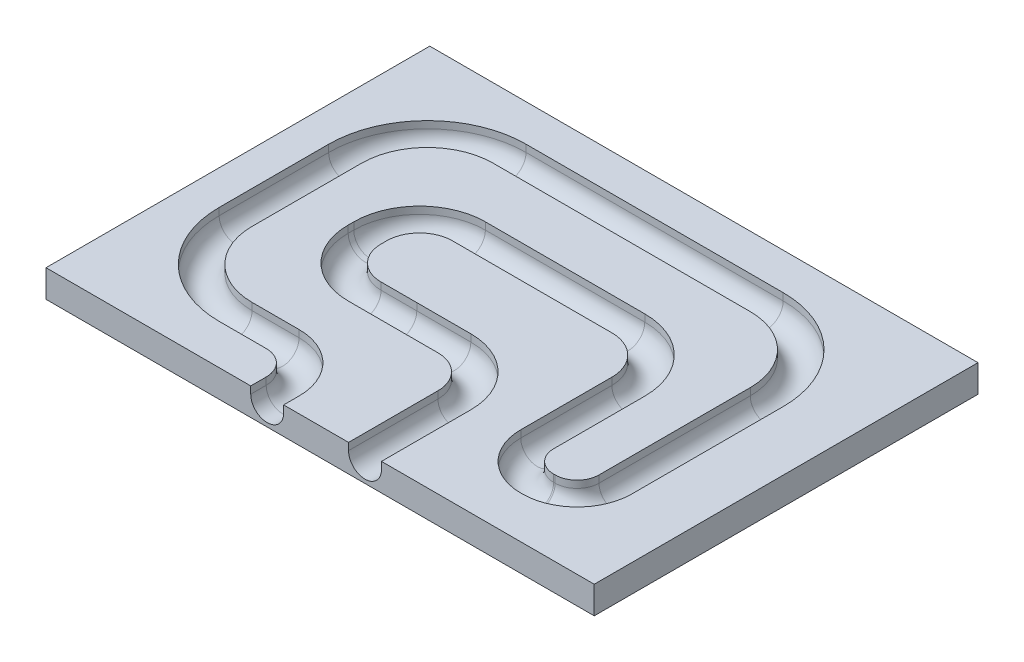
from build123d import *

# Parameters (mm, degrees)
SKETCH1_W           = 254
SKETCH1_H           = 177.8
BOSS_EXTRUDE1_DEPTH = 12.7


with BuildPart() as part:
    # Sketch1 → Boss-Extrude1 (new body)
    with BuildSketch(Plane(origin=(0, 0, 0), x_dir=(1, 0, 0), z_dir=(0, 1, 0))):
        Rectangle(SKETCH1_W, SKETCH1_H)
    extrude(amount=BOSS_EXTRUDE1_DEPTH)

    # Cut-Sweep2: sweep along a path in Sketch2
    with BuildLine(Plane(origin=(0, 12.7, 0), x_dir=(1, 0, 0), z_dir=(0, 1, 0))) as cut_sweep2_path:
        Line((20.796437491, -88.9), (20.796437491, -47.488713932))
        ThreePointArc((20.796437491, -47.488713932), (14.100898509, -31.324252914), (-2.063562509, -24.628713932))
        Line((-2.063562509, -24.628713932), (-27.110242968, -24.628713932))
        Line((-27.110242968, -24.628713932), (-43.640180234, -24.628713932))
        ThreePointArc((-43.640180234, -24.628713932), (-59.804641252, -17.93317495), (-66.500180234, -1.768713932))
        Line((-66.500180234, -1.768713932), (-66.500180234, 0.806968371))
        ThreePointArc((-66.500180234, 0.806968371), (-59.804641252, 16.971429389), (-43.640180234, 23.666968371))
        Line((-43.640180234, 23.666968371), (30.223833761, 23.666968371))
        ThreePointArc((30.223833761, 23.666968371), (48.184346003, 16.227480613), (55.623833761, -1.733031629))
        Line((55.623833761, -1.733031629), (55.623833761, -43.941009117))
        ThreePointArc((55.623833761, -43.941009117), (60.831475192, -56.513367686), (73.403833761, -61.721009117))
        Line((73.403833761, -61.721009117), (74.093236775, -61.721009117))
        ThreePointArc((74.093236775, -61.721009117), (86.665595344, -56.513367686), (91.873236775, -43.941009117))
        Line((91.873236775, -43.941009117), (91.873236775, 26.14139739))
        ThreePointArc((91.873236775, 26.14139739), (80.714005138, 53.082165753), (53.773236775, 64.24139739))
        Line((53.773236775, 64.24139739), (-65.356762302, 64.24139739))
        ThreePointArc((-65.356762302, 64.24139739), (-92.297530666, 53.082165753), (-103.456762302, 26.14139739))
        Line((-103.456762302, 26.14139739), (-103.456762302, -24.595886827))
        ThreePointArc((-103.456762302, -24.595886827), (-92.297530666, -51.53665519), (-65.356762302, -62.695886827))
        Line((-65.356762302, -62.695886827), (-43.57480307, -62.695886827))
        ThreePointArc((-43.57480307, -62.695886827), (-30.104418888, -68.275502645), (-24.52480307, -81.745886827))
        Line((-24.52480307, -81.745886827), (-24.52480307, -88.9))
    # Sketch3 → Cut-Sweep2 (sweep, cut)
    with BuildSketch(Plane.XY.offset(88.9)):
        with BuildLine():
            Line((-16.90480307, 12.7), (-16.90480307, 9.380942321))
            ThreePointArc((-16.90480307, 9.380942321), (-24.52480307, 1.760942321), (-32.14480307, 9.380942321))
            Line((-32.14480307, 9.380942321), (-32.14480307, 12.7))
            ThreePointArc((-32.14480307, 12.7), (-24.52480307, 20.32), (-16.90480307, 12.7))
        make_face()
    sweep(path=cut_sweep2_path.line, mode=Mode.SUBTRACT)


solid = part.part
